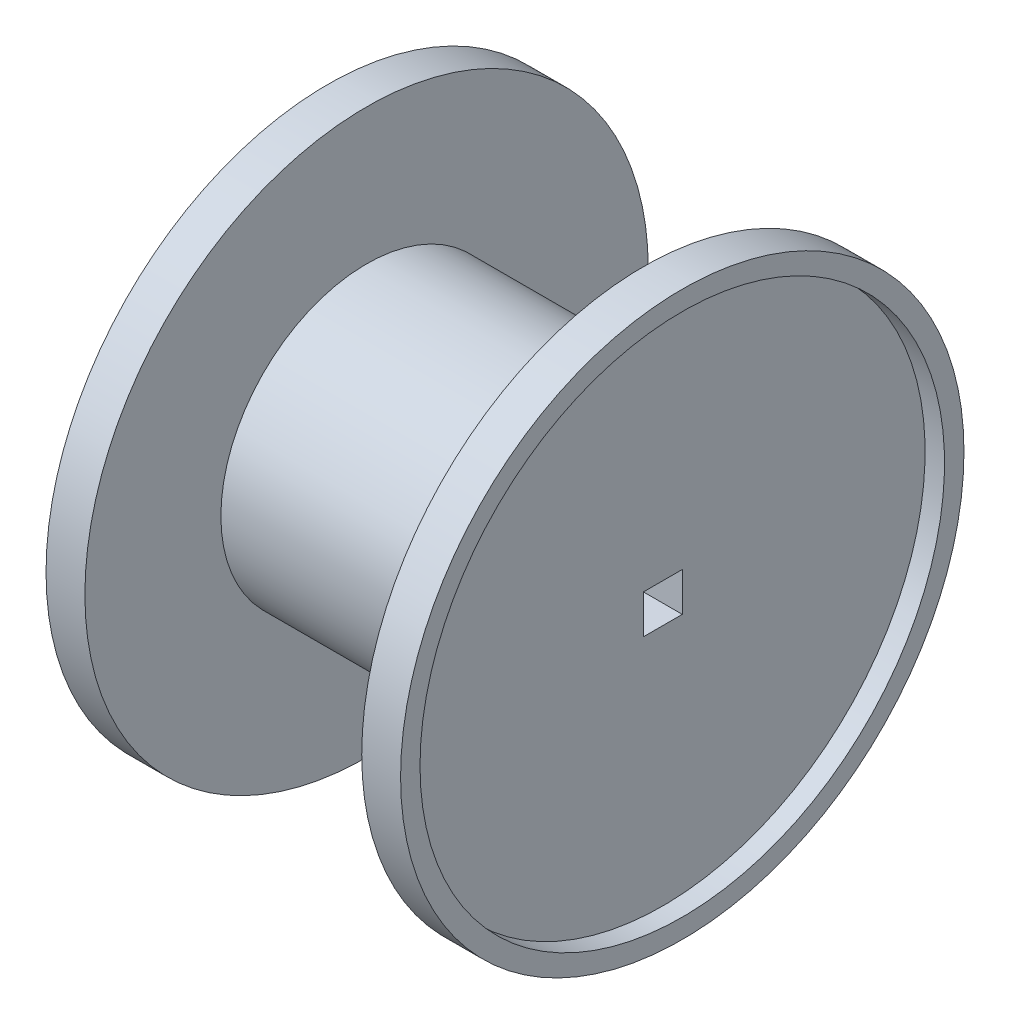
from build123d import *

# Parameters (mm, degrees)
ESQUISSE1_W             = 20
ESQUISSE1_H             = 20
ESQUISSE2_W             = 40
ESQUISSE2_H             = 40
ENL_V_MAT_EXTRU_1_DEPTH = 536.933764564


with BuildPart() as part:
    # Esquisse1 → Révolution1 (revolve)
    with BuildSketch(Plane.XY, mode=Mode.PRIVATE) as r_volution1_sk:
        Polygon((0, 0), (0, 290), (20, 290), (20, 150), (305, 150), (305, 290), (325, 290), (325, 0), align=None)
        with Locations((335, 280)):
            Rectangle(ESQUISSE1_W, ESQUISSE1_H)
        with Locations((-10, 280)):
            Rectangle(ESQUISSE1_W, ESQUISSE1_H)
    revolve(r_volution1_sk.sketch.rotate(Axis((0, 0, 0), (1, 0, 0)), 90), axis=Axis((0, 0, 0), (1, 0, 0)))

    # Esquisse2 → Enlèv. mat.-Extru.1 (cut, through all)
    with BuildSketch(Plane.ZY):
        Rectangle(ESQUISSE2_W, ESQUISSE2_H)
    extrude(amount=-ENL_V_MAT_EXTRU_1_DEPTH, mode=Mode.SUBTRACT)


solid = part.part
